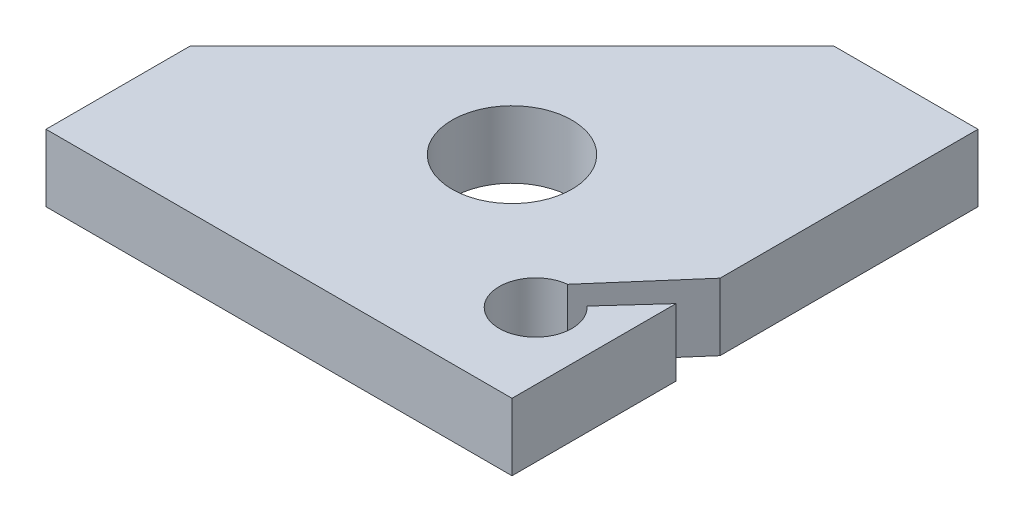
from build123d import *

# Parameters (mm, degrees)
SKETCH1_R           = 6.25
BOSS_EXTRUDE1_DEPTH = 7


with BuildPart() as part:
    # Sketch1 → Boss-Extrude1 (new body)
    with BuildSketch(Plane(origin=(0, 0, 0), x_dir=(1, 0, 0), z_dir=(0, 1, 0))):
        with BuildLine():
            Line((72.34, -63.405178012), (38.75, -96.995178012))
            Line((38.75, -96.995178012), (38.75, -111.995178012))
            Line((38.75, -111.995178012), (87.34, -111.995178012))
            Line((87.34, -111.995178012), (87.34, -94.896256746))
            Line((87.34, -94.896256746), (82.922661505, -99.760117279))
            ThreePointArc((82.922661505, -99.760117279), (79.206389469, -106.17642477), (79.948751144, -98.798852079))
            Line((79.948751144, -98.798852079), (87.34, -90.296256746))
            Line((87.34, -90.296256746), (87.34, -63.405178012))
            Line((87.34, -63.405178012), (72.34, -63.405178012))
        make_face()
        with Locations(Location((65.34, -89.995178012, 0), (0, 0, 270))):
            Circle(SKETCH1_R, mode=Mode.SUBTRACT)
    extrude(amount=BOSS_EXTRUDE1_DEPTH)


solid = part.part
